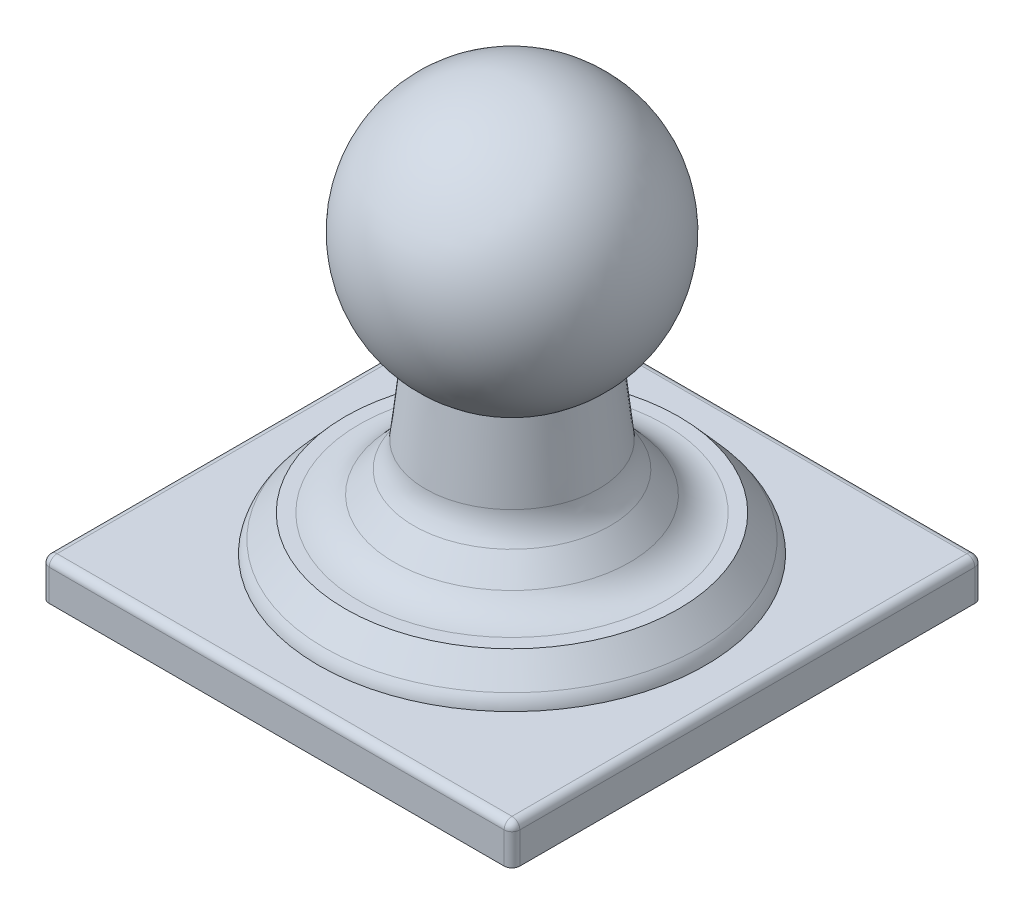
from build123d import *

# Parameters (mm, degrees)
FILLET1_R           = 1.651
FILLET2_R           = 3.048
SKETCH2_W           = 30.48
SKETCH2_H           = 30.48
BOSS_EXTRUDE1_DEPTH = 2.54
FILLET3_R           = 0.508


with BuildPart() as part:
    # Sketch1 → Revolve1 (revolve)
    with BuildSketch(Plane(origin=(0, 0, 0), x_dir=(0, 0, -1), z_dir=(1, 0, 0)), mode=Mode.PRIVATE) as revolve1_sk:
        with BuildLine():
            Line((0, 14.5542), (0, -14.5542))
            Line((0, -14.5542), (12.5603, -14.5542))
            Line((12.5603, -14.5542), (12.5603, -11.698058268))
            Line((12.5603, -11.698058268), (10.796510879, -9.7155))
            Line((10.796510879, -9.7155), (8.532673765, -9.7155))
            Line((8.532673765, -9.7155), (5.715, -6.548339963))
            Line((5.715, -6.548339963), (5.08, -0.795239963))
            ThreePointArc((5.08, -0.795239963), (8.084115709, 8.714342259), (0, 14.5542))
        make_face()
    revolve(revolve1_sk.sketch.rotate(Axis((0, 14.5542, 0), (0, -1, 0)), 180), axis=Axis((0, 14.5542, 0), (0, -1, 0)))

    # Fillet1
    fillet1_edges = [part.edges().sort_by_distance(p)[0] for p in [
        (0, -14.5542, -12.5603),
        (0, -11.698058268, -12.5603),
    ]]
    fillet(fillet1_edges, radius=FILLET1_R)

    # Fillet2
    fillet2_edges = [part.edges().sort_by_distance(p)[0] for p in [
        (0, -9.7155, -8.532673765),
        (0, -6.548339963, -5.715),
    ]]
    fillet(fillet2_edges, radius=FILLET2_R)

    # Sketch2 → Boss-Extrude1 (add)
    with BuildSketch(Plane.XZ.offset(14.5542)):
        Rectangle(SKETCH2_W, SKETCH2_H)
    extrude(amount=-BOSS_EXTRUDE1_DEPTH)

    # Fillet3
    fillet3_edges = [part.edges().sort_by_distance(p)[0] for p in [
        (-15.24, -12.0142, 0),
        (-15.24, -13.2842, -15.24),
        (0, -12.0142, 15.24),
        (-15.24, -13.2842, 15.24),
        (15.24, -12.0142, 0),
        (15.24, -13.2842, 15.24),
        (0, -12.0142, -15.24),
        (15.24, -13.2842, -15.24),
    ]]
    fillet(fillet3_edges, radius=FILLET3_R)


solid = part.part
